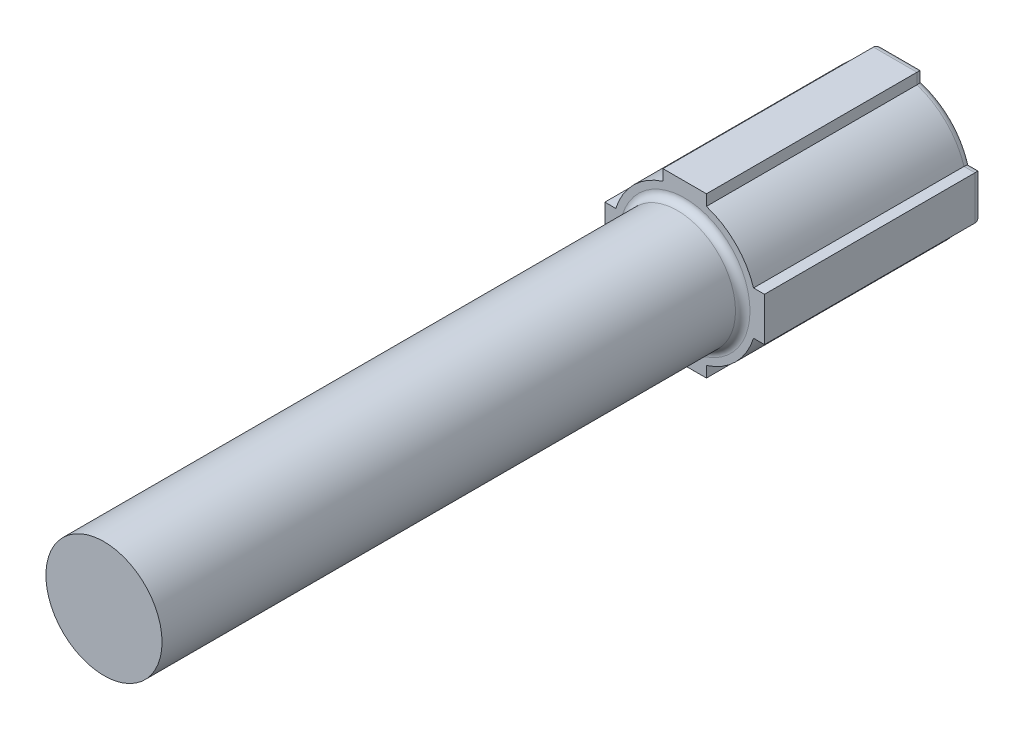
from build123d import *

# Parameters (mm, degrees)
SKETCH1_R           = 9.95
SKETCH1_W           = 6
SKETCH1_H           = 21.99
SKETCH1_W_2         = 21.99
SKETCH1_H_2         = 6
BOSS_EXTRUDE1_DEPTH = 15
SKETCH2_R           = 8
BOSS_EXTRUDE2_DEPTH = 80
FILLET1_R           = 1


with BuildPart() as part:
    # Sketch1 → Boss-Extrude1 (new, symmetric)
    with BuildSketch(Plane.XY):
        Circle(SKETCH1_R)
        Rectangle(SKETCH1_W, SKETCH1_H)
        Rectangle(SKETCH1_W_2, SKETCH1_H_2)
    extrude(amount=BOSS_EXTRUDE1_DEPTH, both=True)

    # Sketch2 → Boss-Extrude2 (add)
    with BuildSketch(Plane.XY.offset(15)):
        Circle(SKETCH2_R)
    extrude(amount=BOSS_EXTRUDE2_DEPTH)

    # Fillet1
    fillet1_edges = [part.edges().sort_by_distance(p)[0] for p in [
        (10.240982371, 3, -15),
        (10.995, 0, -15),
        (10.240982371, -3, -15),
        (-3, 10.240982371, -15),
        (0, 10.995, -15),
        (3, 10.240982371, -15),
        (3, -10.240982371, -15),
        (0, -10.995, -15),
        (-3, -10.240982371, -15),
        (7.035712473, -7.035712473, -15),
        (7.035712473, 7.035712473, -15),
        (-7.035712473, 7.035712473, -15),
        (-7.035712473, -7.035712473, -15),
        (-8, 0, 15),
        (-10.240982371, -3, -15),
        (-10.995, 0, -15),
        (-10.240982371, 3, -15),
    ]]
    fillet(fillet1_edges, radius=FILLET1_R)


solid = part.part
